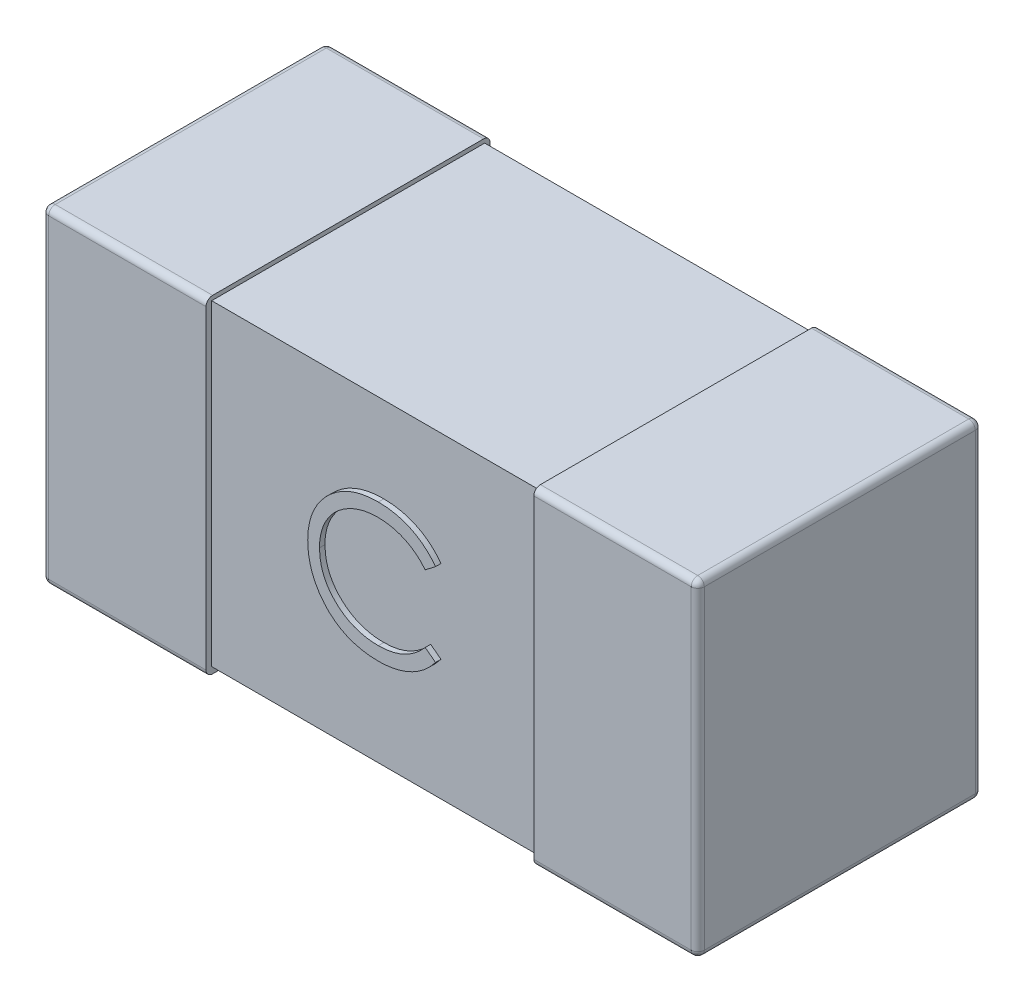
from build123d import *

# Parameters (mm, degrees)
EXTRUDE_1_DEPTH        = 0.255
EXTRUDE_1_DEPTH_BACK   = 0.005
SKETCH_3_W             = 0.15
SKETCH_3_H             = 0.3
EXTRUDE_1_2_DEPTH      = 0.255
EXTRUDE_1_2_DEPTH_BACK = 0.005
SKETCH_5_W             = 0.249832491
SKETCH_5_H             = 0.29
EXTRUDE_3_DEPTH        = 0.155
FILLET_3_R             = 0.006
EXTRUDE_4_DEPTH        = 0.005


with BuildPart() as part:
    # 草图3 → 凸台-拉伸1 (new, two sides: drawn at the far end of the back side and taken through both)
    with BuildSketch(Plane.XY.offset(-EXTRUDE_1_DEPTH_BACK)):
        with Locations((-0.225, 0)):
            Rectangle(SKETCH_3_W, SKETCH_3_H)
    extrude(amount=EXTRUDE_1_DEPTH + EXTRUDE_1_DEPTH_BACK)



with BuildPart() as body_2:
    # 草图3 → Extrude 1 2 (new, two sides: drawn at the far end of the back side and taken through both)
    with BuildSketch(Plane.XY.offset(-EXTRUDE_1_2_DEPTH_BACK)):
        with Locations((0.225, 0)):
            Rectangle(SKETCH_3_W, SKETCH_3_H)
    extrude(amount=EXTRUDE_1_2_DEPTH + EXTRUDE_1_2_DEPTH_BACK)


with BuildPart() as part_1:
    add(part.part)

    add(body_2.part)  # 凸台-拉伸3 merges body 2
    # 草图5 → 凸台-拉伸3 (add, symmetric)
    with BuildSketch(Plane(origin=(0, 0, 0), x_dir=(0, 0, -1), z_dir=(1, 0, 0))):
        with Locations((-0.124916246, 0.001164138)):
            Rectangle(SKETCH_5_W, SKETCH_5_H)
    extrude(amount=EXTRUDE_3_DEPTH, both=True)

    # 圆角3
    fillet_3_edges = [part_1.edges().sort_by_distance(p)[0] for p in [
        (-0.3, 0, -0.005),
        (-0.225, 0.15, 0.255),
        (-0.225, -0.15, -0.005),
        (-0.3, 0, 0.255),
        (-0.225, -0.15, 0.255),
        (0.3, 0.15, 0.125),
        (0.3, 0, -0.005),
        (0.3, -0.15, 0.125),
        (0.225, -0.15, -0.005),
        (0.225, 0.15, -0.005),
        (0.3, 0, 0.255),
        (0.225, 0.15, 0.255),
        (0.225, -0.15, 0.255),
        (-0.225, 0.15, -0.005),
        (-0.3, -0.15, 0.125),
        (-0.3, 0.15, 0.125),
    ]]
    fillet(fillet_3_edges, radius=FILLET_3_R)

    # 草图6 → 凸台-拉伸4 (add)
    with BuildSketch(Plane.XY.offset(0.249832491)):
        with BuildLine():
            Line((0.059820762, 0.042787592), (0.050397685, 0.035576054))
            add(Edge.make_bspline(
                [(0.050397685, 0.035576054), (0.049725483, 0.036377173), (0.048390142, 0.03796861), (0.046241826, 0.040203337), (0.044002913, 0.042297003), (0.041674257, 0.044259582), (0.039213945, 0.046022442), (0.036681575, 0.047677452), (0.034034784, 0.049160917), (0.030374725, 0.050959648), (0.025586799, 0.052836659), (0.019559547, 0.054410484), (0.013267738, 0.055412353), (0.008975249, 0.055520862), (0.006791916, 0.055576054)],
                knots=[0, 0, 0, 0, 0.757959112, 1.505699292, 2.245454638, 2.979532153, 3.711538275, 4.438200793, 5.171680507, 5.909471876, 7.393775596, 8.890124382, 10.418191784, 12, 12, 12, 12], degree=3))
            add(Edge.make_bspline(
                [(0.006791916, 0.055576054), (0.00558906, 0.055562204), (0.003194511, 0.055534632), (-0.000359151, 0.05517089), (-0.003846455, 0.054659649), (-0.007265134, 0.053901066), (-0.010610835, 0.052942005), (-0.013905432, 0.051795991), (-0.017101224, 0.050378111), (-0.020242421, 0.04881097), (-0.023251994, 0.047040887), (-0.026099595, 0.045110143), (-0.02877484, 0.043040346), (-0.031279844, 0.040823736), (-0.033617168, 0.038470298), (-0.035769876, 0.035954949), (-0.037730518, 0.033285731), (-0.039537959, 0.030497843), (-0.041156681, 0.027599404), (-0.042511992, 0.024579688), (-0.043712167, 0.021490404), (-0.044661855, 0.01829665), (-0.045413553, 0.015020898), (-0.045932216, 0.011654357), (-0.046291821, 0.008204059), (-0.046319255, 0.005865454), (-0.046333084, 0.004686631)],
                knots=[0, 0, 0, 0, 1.054917814, 2.100044995, 3.131103042, 4.146048494, 5.169673617, 6.183595914, 7.203665975, 8.234915748, 9.262203917, 10.264457458, 11.251630812, 12.227803204, 13.197192746, 14.159520551, 15.12972552, 16.100847026, 17.073214652, 18.039054194, 19.002613845, 19.979014051, 20.95965708, 21.949030935, 22.966165397, 24, 24, 24, 24], degree=3))
            add(Edge.make_bspline(
                [(-0.046333084, 0.004686631), (-0.046289822, 0.002912985), (-0.046204882, -0.000569332), (-0.045448939, -0.005670038), (-0.044300193, -0.010556462), (-0.042578516, -0.015198056), (-0.040455577, -0.019652057), (-0.037773042, -0.023843103), (-0.034666189, -0.027834528), (-0.031091066, -0.031532001), (-0.027168581, -0.034909614), (-0.022960082, -0.03788392), (-0.018476049, -0.040363287), (-0.013765993, -0.042426463), (-0.008793669, -0.044012408), (-0.003568019, -0.045128892), (0.001899593, -0.045857195), (0.005635686, -0.045926922), (0.007537108, -0.045962408)],
                knots=[0, 0, 0, 0, 1.029171465, 2.020641659, 2.987623507, 3.938342917, 4.889210282, 5.84687017, 6.821220943, 7.821438502, 8.827599549, 9.822697543, 10.807740252, 11.797342354, 12.80366471, 13.83203677, 14.896651826, 16, 16, 16, 16], degree=3))
            add(Edge.make_bspline(
                [(0.007537108, -0.045962408), (0.009632057, -0.045904507), (0.013755419, -0.045790544), (0.019802323, -0.044825084), (0.025590977, -0.043259669), (0.031121695, -0.041068884), (0.036378882, -0.038220931), (0.041370768, -0.034768432), (0.046101565, -0.030678546), (0.048946294, -0.027555696), (0.050397685, -0.025962408)],
                knots=[0, 0, 0, 0, 1.028121516, 2.023589091, 2.998037872, 3.967518031, 4.937445131, 5.927275754, 6.942489185, 8, 8, 8, 8], degree=3))
            Line((0.050397685, -0.025962408), (0.059820762, -0.033101831))
            add(Edge.make_bspline(
                [(0.059820762, -0.033101831), (0.059062427, -0.034080292), (0.057549389, -0.036032528), (0.055099399, -0.038784701), (0.052518464, -0.04137341), (0.049787411, -0.043777786), (0.046937658, -0.046045939), (0.043918036, -0.04811343), (0.04076824, -0.050009118), (0.037498944, -0.051744898), (0.03411362, -0.053284918), (0.030616325, -0.054603333), (0.027022134, -0.055739043), (0.023330882, -0.056673396), (0.019534913, -0.05740269), (0.015647926, -0.057890222), (0.01166153, -0.05822423), (0.00897211, -0.058254673), (0.007609223, -0.0582701)],
                knots=[0, 0, 0, 0, 0.986787822, 1.968848986, 2.935600012, 3.899624008, 4.868462664, 5.837806735, 6.815139263, 7.798259679, 8.787526145, 9.778297419, 10.776456485, 11.791383307, 12.812564526, 13.85620153, 14.913611965, 16, 16, 16, 16], degree=3))
            add(Edge.make_bspline(
                [(0.007609223, -0.0582701), (0.006318583, -0.058261118), (0.003766503, -0.058243356), (-1.455e-06, -0.057955624), (-0.003669669, -0.057563062), (-0.007227656, -0.056971971), (-0.010694832, -0.056274451), (-0.014039767, -0.055339437), (-0.017295374, -0.054292037), (-0.020448574, -0.053061009), (-0.02350205, -0.051671882), (-0.026445952, -0.050101886), (-0.029278926, -0.048364222), (-0.032028827, -0.046497193), (-0.034655029, -0.044440829), (-0.037180293, -0.042223687), (-0.039618778, -0.039853241), (-0.041127442, -0.038143931), (-0.041885969, -0.037284523)],
                knots=[0, 0, 0, 0, 1.114604814, 2.203992996, 3.262667896, 4.300477797, 5.318619304, 6.316056647, 7.298880507, 8.271930387, 9.238335007, 10.195173496, 11.151986948, 12.108099108, 13.064862484, 14.031167946, 15.010108607, 16, 16, 16, 16], degree=3))
            add(Edge.make_bspline(
                [(-0.041885969, -0.037284523), (-0.043100905, -0.035791682), (-0.04551611, -0.032824024), (-0.048606134, -0.028014219), (-0.051251193, -0.022992452), (-0.053389796, -0.01773234), (-0.055061661, -0.012245686), (-0.056219873, -0.006529726), (-0.0569725, -0.000589796), (-0.057058567, 0.003450322), (-0.057102315, 0.005503938)],
                knots=[0, 0, 0, 0, 0.994628077, 1.977248131, 2.950237994, 3.925870899, 4.908910175, 5.911660606, 6.938484602, 8, 8, 8, 8], degree=3))
            add(Edge.make_bspline(
                [(-0.057102315, 0.005503938), (-0.057048994, 0.007662411), (-0.056944089, 0.011909071), (-0.056052804, 0.018141321), (-0.054619017, 0.024112226), (-0.052582552, 0.02981064), (-0.050000654, 0.035266536), (-0.04681117, 0.040438234), (-0.043051154, 0.04535881), (-0.038750095, 0.049953602), (-0.0340335, 0.054154951), (-0.02898257, 0.057851164), (-0.023607189, 0.060927193), (-0.017966576, 0.06349849), (-0.012018496, 0.065474871), (-0.005775638, 0.066858409), (0.000750268, 0.067719567), (0.005202694, 0.067828432), (0.007464993, 0.067883746)],
                knots=[0, 0, 0, 0, 1.032925535, 2.032216505, 3.007276963, 3.968222605, 4.92396291, 5.891752235, 6.871517503, 7.883894988, 8.900124299, 9.891468569, 10.874487609, 11.85992873, 12.854644235, 13.869047385, 14.917252991, 16, 16, 16, 16], degree=3))
            add(Edge.make_bspline(
                [(0.007464993, 0.067883746), (0.008843774, 0.067867216), (0.011572934, 0.067834495), (0.015610168, 0.067515428), (0.019540762, 0.066983532), (0.023367425, 0.066259553), (0.027108771, 0.065361016), (0.030736208, 0.064190492), (0.03427102, 0.062852096), (0.037690914, 0.061310663), (0.040979482, 0.059580375), (0.044135698, 0.057680411), (0.047134494, 0.055613126), (0.049996968, 0.053396103), (0.052675238, 0.050982438), (0.055245346, 0.04843852), (0.057620012, 0.045691075), (0.059085836, 0.043757191), (0.059820762, 0.042787592)],
                knots=[0, 0, 0, 0, 1.096760587, 2.17092713, 3.219439832, 4.250915756, 5.268269357, 6.278326846, 7.281116186, 8.274029601, 9.260640565, 10.235837813, 11.203064059, 12.156899882, 13.114053108, 14.069676657, 15.032185724, 16, 16, 16, 16], degree=3))
        make_face()
    extrude(amount=EXTRUDE_4_DEPTH)


solid = part_1.part
